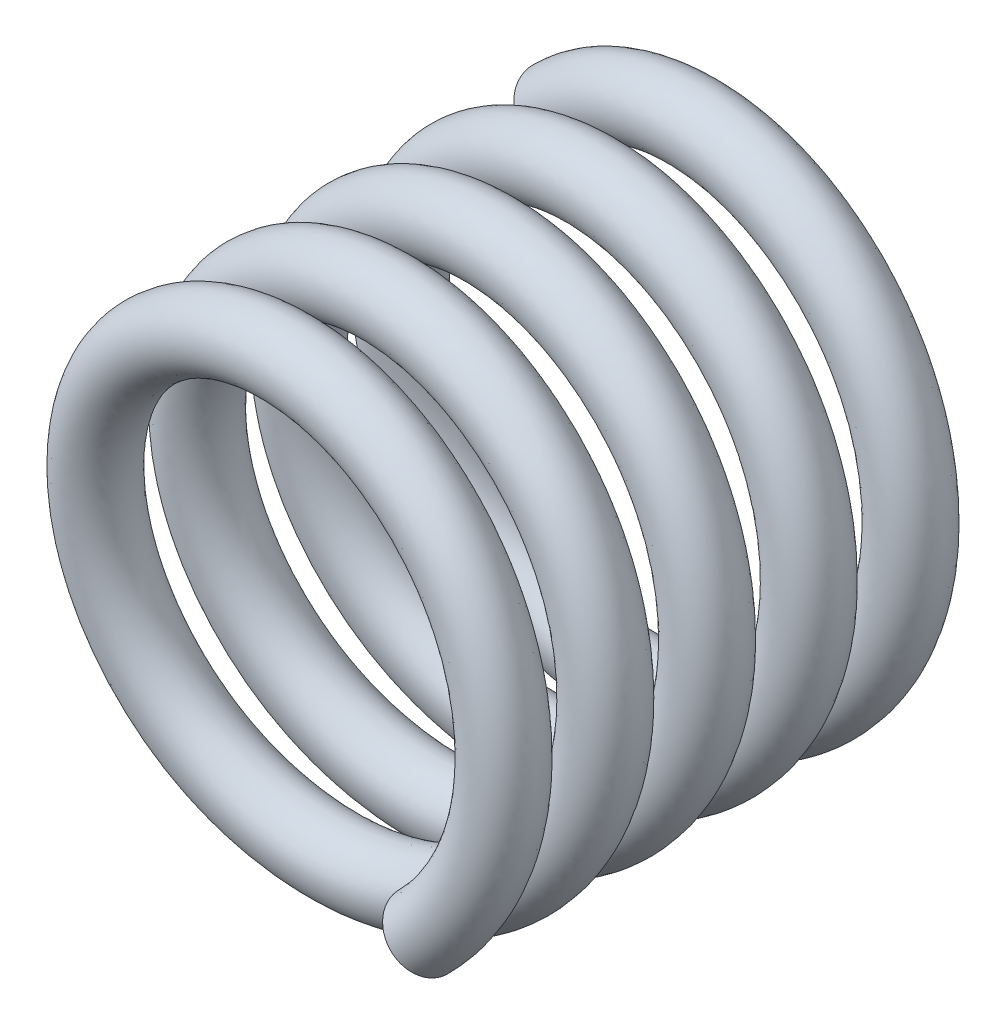
from build123d import *

# Parameters (mm, degrees)
SWEEP1_PITCH       = 1.111111111
SWEEP1_HEIGHT      = 5
SWEEP1_RADIUS      = 2.5
SWEEP1_START_ANGLE = 135
SWEEP1_PROFILE_R   = 0.375


with BuildPart() as part:
    # Sweep1: sweep along a helix
    with BuildLine() as sweep1_path:
        add(Helix(SWEEP1_PITCH, SWEEP1_HEIGHT, SWEEP1_RADIUS, center=(0, 0, 0), direction=(0, 0, 1), lefthand=True, mode=Mode.PRIVATE).rotate(Axis((0, 0, 0), (0, 0, 1)), SWEEP1_START_ANGLE))
    # Sweep1 profile (on start of the path) → Sweep1 (sweep)
    with BuildSketch(Plane(origin=(-1.767766953, 1.767766953, 0), x_dir=(0.7071067811867141, -0.707106781186381, 0), z_dir=(0.7053443822993557, 0.705344382299688, 0.07055922843265794))):
        Circle(SWEEP1_PROFILE_R)
    sweep(path=sweep1_path.line, is_frenet=True)


solid = part.part
